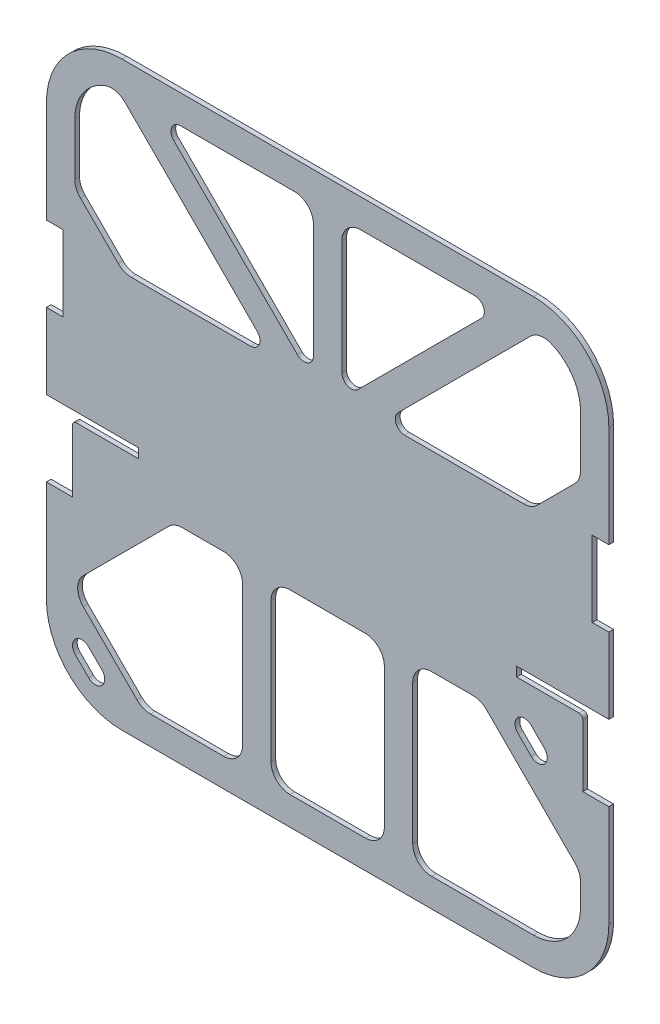
from build123d import *

# Parameters (mm, degrees)
BOSS_EXTRUDE1_DEPTH = 1.5875


with BuildPart() as part:
    # Sketch1 → Boss-Extrude1 (new body)
    with BuildSketch(Plane.XY.offset(-447.675)):
        with BuildLine():
            Line((94.488, -85.725), (88.9, -85.725))
            Line((88.9, -85.725), (88.9, -60.325))
            Line((88.9, -60.325), (94.488, -60.325))
            Line((94.488, -60.325), (94.488, -26.162))
            ThreePointArc((94.488, -26.162), (87.048512242, -8.201487758), (69.088, -0.762))
            Line((69.088, -0.762), (-69.088, -0.762))
            ThreePointArc((-69.088, -0.762), (-87.048512242, -8.201487758), (-94.488, -26.162))
            Line((-94.488, -26.162), (-94.488, -60.325))
            Line((-94.488, -60.325), (-88.9, -60.325))
            Line((-88.9, -60.325), (-88.9, -85.725))
            Line((-88.9, -85.725), (-94.488, -85.725))
            Line((-94.488, -85.725), (-94.488, -111.125))
            Line((-94.488, -111.125), (-63.5, -111.125))
            Line((-63.5, -111.125), (-63.5, -114.3))
            Line((-63.5, -114.3), (-84.455, -114.3))
            ThreePointArc((-84.455, -114.3), (-85.353025612, -114.671974388), (-85.725, -115.57))
            Line((-85.725, -115.57), (-85.725, -136.525))
            Line((-85.725, -136.525), (-94.488, -136.525))
            Line((-94.488, -136.525), (-94.488, -170.688))
            ThreePointArc((-94.488, -170.688), (-87.048512242, -188.648512242), (-69.088, -196.088))
            Line((-69.088, -196.088), (69.088, -196.088))
            ThreePointArc((69.088, -196.088), (87.048512242, -188.648512242), (94.488, -170.688))
            Line((94.488, -170.688), (94.488, -136.525))
            Line((94.488, -136.525), (85.725, -136.525))
            Line((85.725, -136.525), (85.725, -115.57))
            ThreePointArc((85.725, -115.57), (85.353025612, -114.671974388), (84.455, -114.3))
            Line((84.455, -114.3), (63.5, -114.3))
            Line((63.5, -114.3), (63.5, -111.125))
            Line((63.5, -111.125), (94.488, -111.125))
            Line((94.488, -111.125), (94.488, -85.725))
        make_face()
        with BuildLine():
            Line((-48.874039546, -127), (-34.925, -127))
            ThreePointArc((-34.925, -127), (-30.434871939, -128.859871939), (-28.575, -133.35))
            Line((-28.575, -133.35), (-28.575, -180.213))
            ThreePointArc((-28.575, -180.213), (-30.434871939, -184.703128061), (-34.925, -186.563))
            Line((-34.925, -186.563), (-59.563, -186.563))
            ThreePointArc((-59.563, -186.563), (-61.993039796, -186.079635031), (-64.053128061, -184.703128061))
            Line((-64.053128061, -184.703128061), (-82.140147834, -166.616108288))
            ThreePointArc((-82.140147834, -166.616108288), (-84.000019773, -162.125980227), (-82.140147834, -157.635852166))
            Line((-82.140147834, -157.635852166), (-53.364167607, -128.859871939))
            ThreePointArc((-53.364167607, -128.859871939), (-51.304079342, -127.483364969), (-48.874039546, -127))
        make_face(mode=Mode.SUBTRACT)
        with BuildLine():
            Line((28.575, -133.35), (28.575, -180.213))
            ThreePointArc((28.575, -180.213), (30.434871939, -184.703128061), (34.925, -186.563))
            Line((34.925, -186.563), (69.088, -186.563))
            ThreePointArc((69.088, -186.563), (80.313320151, -181.913320151), (84.963, -170.688))
            Line((84.963, -170.688), (84.963, -163.088960454))
            ThreePointArc((84.963, -163.088960454), (84.479635031, -160.658920658), (83.103128061, -158.598832393))
            Line((83.103128061, -158.598832393), (53.364167607, -128.859871939))
            ThreePointArc((53.364167607, -128.859871939), (51.304079342, -127.483364969), (48.874039546, -127))
            Line((48.874039546, -127), (34.925, -127))
            ThreePointArc((34.925, -127), (30.434871939, -128.859871939), (28.575, -133.35))
        make_face(mode=Mode.SUBTRACT)
        with BuildLine():
            Line((-12.7, -127), (12.7, -127))
            ThreePointArc((12.7, -127), (17.190128061, -128.859871939), (19.05, -133.35))
            Line((19.05, -133.35), (19.05, -180.213))
            ThreePointArc((19.05, -180.213), (17.190128061, -184.703128061), (12.7, -186.563))
            Line((12.7, -186.563), (-12.7, -186.563))
            ThreePointArc((-12.7, -186.563), (-17.190128061, -184.703128061), (-19.05, -180.213))
            Line((-19.05, -180.213), (-19.05, -133.35))
            ThreePointArc((-19.05, -133.35), (-17.190128061, -128.859871939), (-12.7, -127))
        make_face(mode=Mode.SUBTRACT)
        with BuildLine():
            Line((-84.963, -26.162), (-84.963, -43.671231637))
            ThreePointArc((-84.963, -43.671231637), (-84.479635031, -46.101271432), (-83.103128061, -48.161359697))
            Line((-83.103128061, -48.161359697), (-70.401634909, -60.862852849))
            ThreePointArc((-70.401634909, -60.862852849), (-68.341546644, -62.23935982), (-65.911506848, -62.722724789))
            Line((-65.911506848, -62.722724789), (-25.898012242, -62.722724789))
            ThreePointArc((-25.898012242, -62.722724789), (-22.964694726, -60.762744686), (-23.652948212, -57.302660758))
            Line((-23.652948212, -57.302660758), (-68.129730486, -12.825878484))
            ThreePointArc((-68.129730486, -12.825878484), (-71.341107932, -11.096095222), (-74.974430911, -11.418677575))
            ThreePointArc((-74.974430911, -11.418677575), (-82.230730228, -17.257828666), (-84.963, -26.162))
        make_face(mode=Mode.SUBTRACT)
        with BuildLine():
            Line((-49.461238683, -10.358858045), (-11.1125, -10.358858045))
            ThreePointArc((-11.1125, -10.358858045), (-6.622371939, -12.218729985), (-4.7625, -16.708858045))
            Line((-4.7625, -16.708858045), (-4.7625, -55.057596728))
            ThreePointArc((-4.7625, -55.057596728), (-6.722480102, -57.990914244), (-10.18256403, -57.302660758))
            Line((-10.18256403, -57.302660758), (-51.706302713, -15.778922075))
            ThreePointArc((-51.706302713, -15.778922075), (-52.394556199, -12.318838147), (-49.461238683, -10.358858045))
        make_face(mode=Mode.SUBTRACT)
        with BuildLine():
            Line((4.7625, -16.708858045), (4.7625, -55.057596728))
            ThreePointArc((4.7625, -55.057596728), (6.722480102, -57.990914244), (10.18256403, -57.302660758))
            Line((10.18256403, -57.302660758), (51.706302713, -15.778922075))
            ThreePointArc((51.706302713, -15.778922075), (52.394556199, -12.318838147), (49.461238683, -10.358858045))
            Line((49.461238683, -10.358858045), (11.1125, -10.358858045))
            ThreePointArc((11.1125, -10.358858045), (6.622371939, -12.218729985), (4.7625, -16.708858045))
        make_face(mode=Mode.SUBTRACT)
        with BuildLine():
            Line((68.129730486, -12.825878484), (23.652948212, -57.302660758))
            ThreePointArc((23.652948212, -57.302660758), (22.964694726, -60.762744686), (25.898012242, -62.722724789))
            Line((25.898012242, -62.722724789), (65.911506848, -62.722724789))
            ThreePointArc((65.911506848, -62.722724789), (68.341546644, -62.23935982), (70.401634909, -60.862852849))
            Line((70.401634909, -60.862852849), (83.103128061, -48.161359697))
            ThreePointArc((83.103128061, -48.161359697), (84.479635031, -46.101271432), (84.963, -43.671231637))
            Line((84.963, -43.671231637), (84.963, -26.162))
            ThreePointArc((84.963, -26.162), (82.230730228, -17.257828666), (74.974430911, -11.418677575))
            ThreePointArc((74.974430911, -11.418677575), (71.341107932, -11.096095222), (68.129730486, -12.825878484))
        make_face(mode=Mode.SUBTRACT)
        with BuildLine():
            Line((68.383887592, -125.919079683), (72.874015653, -130.409207744))
            ThreePointArc((72.874015653, -130.409207744), (72.874015653, -134.899335804), (68.383887592, -134.899335804))
            Line((68.383887592, -134.899335804), (63.893759532, -130.409207744))
            ThreePointArc((63.893759532, -130.409207744), (63.893759532, -125.919079683), (68.383887592, -125.919079683))
        make_face(mode=Mode.SUBTRACT)
        with BuildLine():
            Line((-80.313320151, -177.423192091), (-75.823192091, -181.913320151))
            ThreePointArc((-75.823192091, -181.913320151), (-75.823192091, -186.403448212), (-80.313320151, -186.403448212))
            Line((-80.313320151, -186.403448212), (-84.803448212, -181.913320151))
            ThreePointArc((-84.803448212, -181.913320151), (-84.803448212, -177.423192091), (-80.313320151, -177.423192091))
        make_face(mode=Mode.SUBTRACT)
    extrude(amount=-BOSS_EXTRUDE1_DEPTH)


solid = part.part
